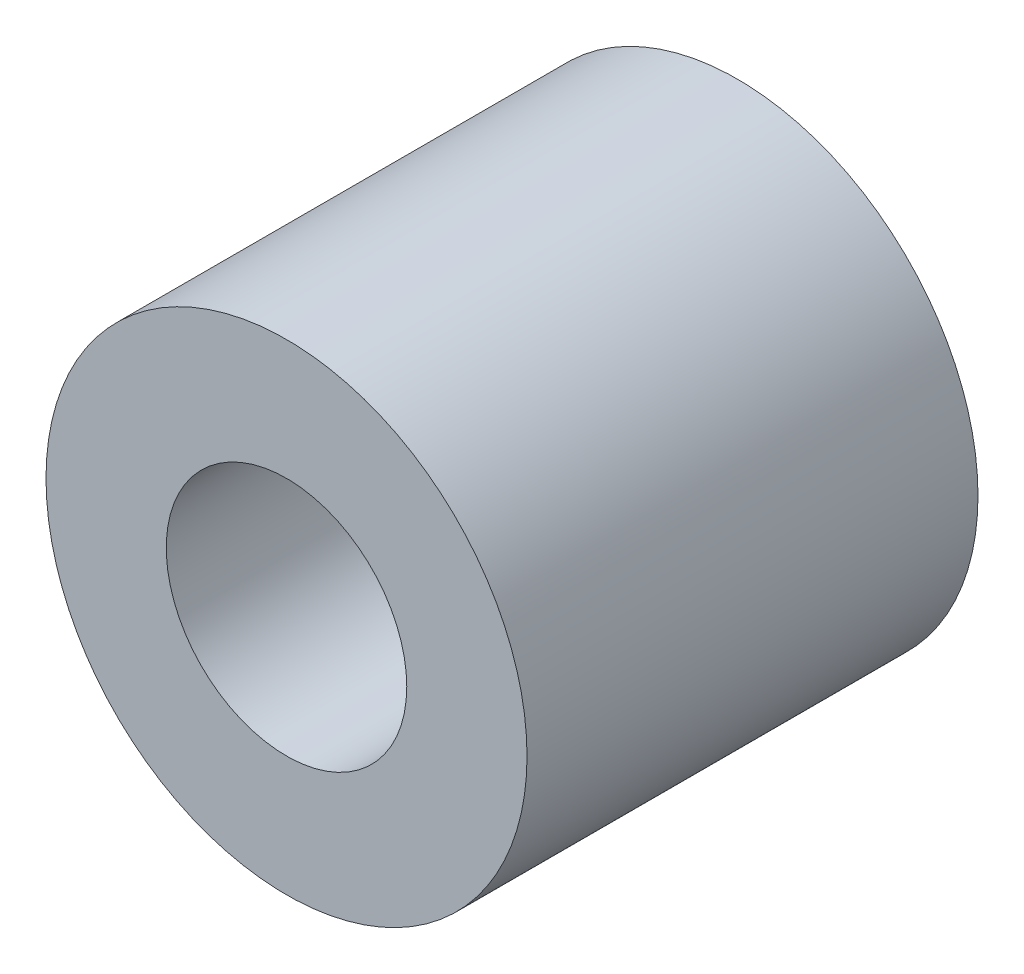
from build123d import *

# Parameters (mm, degrees)
SKETCH1_R           = 8
BOSS_EXTRUDE1_DEPTH = 15
SKETCH2_R           = 4
CUT_EXTRUDE1_DEPTH  = 14


with BuildPart() as part:
    # Sketch1 → Boss-Extrude1 (new body)
    with BuildSketch(Plane.XY):
        Circle(SKETCH1_R)
    extrude(amount=BOSS_EXTRUDE1_DEPTH)

    # Sketch2 → Cut-Extrude1 (cut)
    with BuildSketch(Plane.XY.offset(15)):
        Circle(SKETCH2_R)
    extrude(amount=-CUT_EXTRUDE1_DEPTH, mode=Mode.SUBTRACT)


solid = part.part
